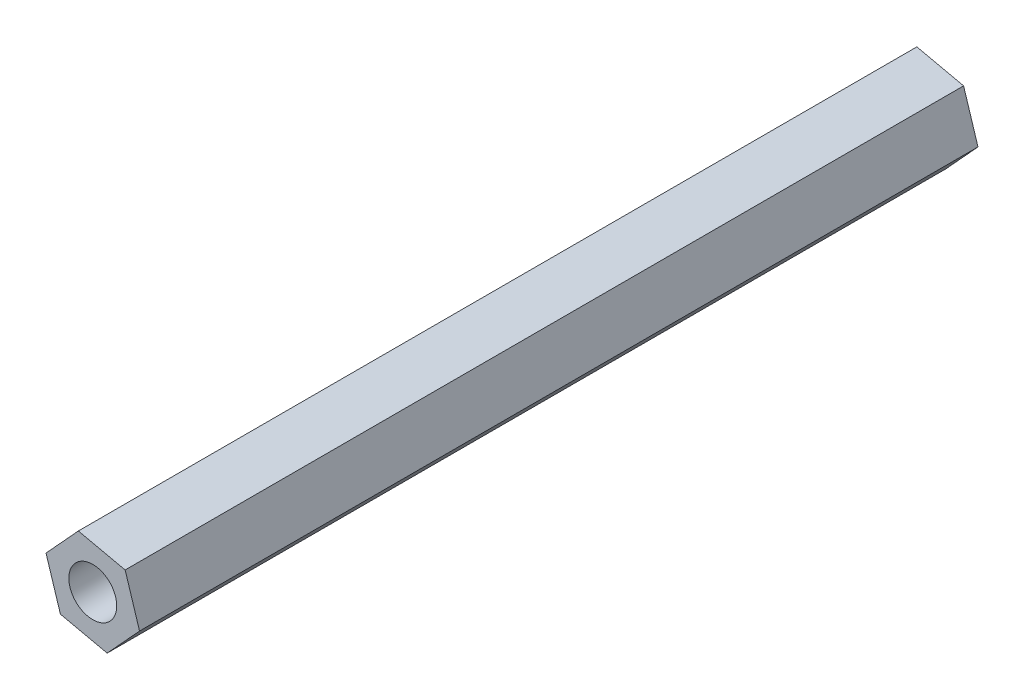
from build123d import *

# Parameters (mm, degrees)
SKETCH_1_R      = 2
EXTRUDE_1_DEPTH = 70


with BuildPart() as part:
    # 草图1 → 凸台-拉伸1 (new body)
    with BuildSketch(Plane.XY):
        Polygon((-154.202582042, 46.07994383), (-156.905129291, 43.131005315), (-155.702547246, 39.316061485), (-151.797417954, 38.45005617), (-149.094870705, 41.398994685), (-150.297452749, 45.213938515), align=None)
        with Locations((-152.999999998, 42.265)):
            Circle(SKETCH_1_R, mode=Mode.SUBTRACT)
    extrude(amount=EXTRUDE_1_DEPTH)


solid = part.part
